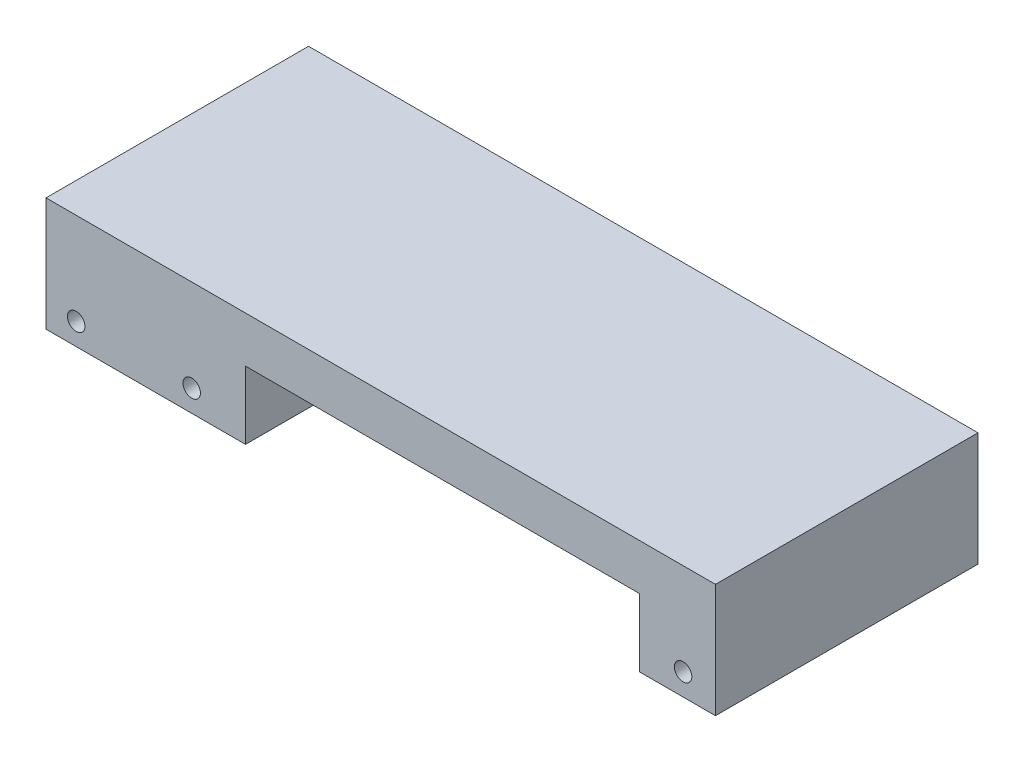
from build123d import *

# Parameters (mm, degrees)
CROQUIS1_R              = 1
SALIENTE_EXTRUIR1_DEPTH = 30


with BuildPart() as part:
    # Croquis1 → Saliente-Extruir1 (new body)
    with BuildSketch(Plane.XY):
        Polygon((-38.25, 6.5), (-38.25, -6.5), (-15.45, -6.5), (-15.45, 1.25), (29.55, 1.25), (29.55, -6.5), (38.25, -6.5), (38.25, 6.5), align=None)
        with Locations((-34.8, -4)):
            Circle(CROQUIS1_R, mode=Mode.SUBTRACT)
        with Locations((-21.6, -4)):
            Circle(CROQUIS1_R, mode=Mode.SUBTRACT)
        with Locations((34.55, -4)):
            Circle(CROQUIS1_R, mode=Mode.SUBTRACT)
    extrude(amount=SALIENTE_EXTRUIR1_DEPTH)


solid = part.part
